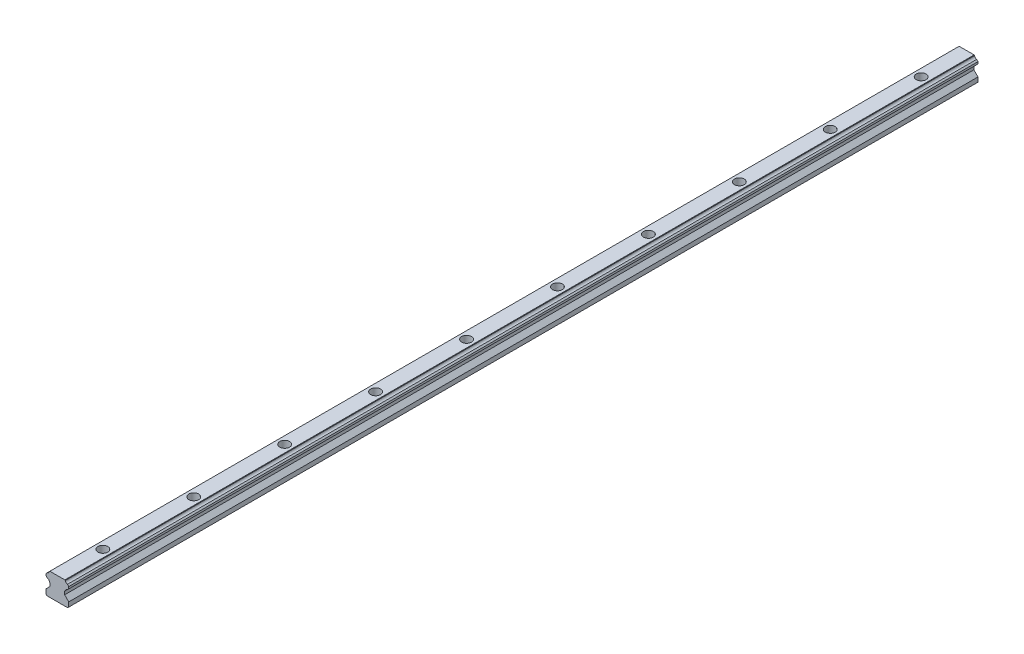
from build123d import *

# Parameters (mm, degrees)
EXTRUDE_1_DEPTH     = 600
SKETCH_2_R          = 3.25
CUT_EXTRUDE_1_DEPTH = 5.3
SKETCH_3_R          = 2.25
CUT_EXTRUDE_2_DEPTH = 601.125270256


with BuildPart() as part:
    # Model → Бобышка-Вытянуть1 (new body)
    with BuildSketch(Plane.XY):
        with BuildLine():
            Line((6.8, 0), (7.5, 0.7))
            Line((7.5, 0.7), (7.5, 3.6994391))
            Line((7.5, 3.6994391), (4.7998047, 6.3996344))
            Line((4.7998047, 6.3996344), (4.7998047, 8.409149262))
            Line((4.7998047, 8.409149262), (5.20075838, 8.810103152))
            ThreePointArc((5.20075838, 8.810103152), (5.668922208, 9.789261508), (6.648080611, 10.257425237))
            Line((6.648080611, 10.257425237), (7.5, 11.109345046))
            Line((7.5, 11.109345046), (7.5, 12.449454443))
            Line((7.5, 12.449454443), (6.634490912, 13.314965186))
            ThreePointArc((6.634490912, 13.314965186), (5.668922174, 13.781617126), (5.202270193, 14.747185846))
            Line((5.202270193, 14.747185846), (4.949456226, 15))
            Line((4.949456226, 15), (-4.949456226, 15))
            Line((-4.949456226, 15), (-5.202270193, 14.747185846))
            ThreePointArc((-5.202270193, 14.747185846), (-5.668922174, 13.781617126), (-6.634490912, 13.314965186))
            Line((-6.634490912, 13.314965186), (-7.5, 12.449454443))
            Line((-7.5, 12.449454443), (-7.5, 11.109345046))
            Line((-7.5, 11.109345046), (-6.648080611, 10.257425238))
            ThreePointArc((-6.648080611, 10.257425238), (-5.668922208, 9.789261508), (-5.20075838, 8.810103152))
            Line((-5.20075838, 8.810103152), (-4.7998047, 8.409149262))
            Line((-4.7998047, 8.409149262), (-4.7998047, 6.3996344))
            Line((-4.7998047, 6.3996344), (-7.5, 3.6994391))
            Line((-7.5, 3.6994391), (-7.5, 0.7))
            Line((-7.5, 0.7), (-6.8, 0))
            Line((-6.8, 0), (6.8, 0))
        make_face()
    extrude(amount=EXTRUDE_1_DEPTH)

    # Эскиз2 → Вырез-Вытянуть1 (cut)
    with BuildSketch(Plane(origin=(0, 15, 0), x_dir=(1, 0, 0), z_dir=(0, 1, 0))):
        with Locations(Location((0, -30, 0), (0, 0, 180))):
            Circle(SKETCH_2_R)
        with Locations(Location((0, -90, 0), (0, 0, 180))):
            Circle(SKETCH_2_R)
        with Locations(Location((0, -150, 0), (0, 0, 180))):
            Circle(SKETCH_2_R)
        with Locations(Location((0, -210, 0), (0, 0, 180))):
            Circle(SKETCH_2_R)
        with Locations(Location((0, -270, 0), (0, 0, 180))):
            Circle(SKETCH_2_R)
        with Locations(Location((0, -330, 0), (0, 0, 180))):
            Circle(SKETCH_2_R)
        with Locations(Location((0, -390, 0), (0, 0, 180))):
            Circle(SKETCH_2_R)
        with Locations(Location((0, -450, 0), (0, 0, 180))):
            Circle(SKETCH_2_R)
        with Locations(Location((0, -510, 0), (0, 0, 180))):
            Circle(SKETCH_2_R)
        with Locations(Location((0, -570, 0), (0, 0, 180))):
            Circle(SKETCH_2_R)
    extrude(amount=-CUT_EXTRUDE_1_DEPTH, mode=Mode.SUBTRACT)

    # Эскиз3 → Вырез-Вытянуть2 (cut, through all)
    with BuildSketch(Plane(origin=(0, 9.7, 0), x_dir=(1, 0, 0), z_dir=(0, 1, 0))):
        with Locations(Location((0, -30, 0), (0, 0, 180))):
            Circle(SKETCH_3_R)
        with Locations(Location((0, -90, 0), (0, 0, 180))):
            Circle(SKETCH_3_R)
        with Locations(Location((0, -150, 0), (0, 0, 180))):
            Circle(SKETCH_3_R)
        with Locations(Location((0, -210, 0), (0, 0, 180))):
            Circle(SKETCH_3_R)
        with Locations(Location((0, -270, 0), (0, 0, 180))):
            Circle(SKETCH_3_R)
        with Locations(Location((0, -330, 0), (0, 0, 180))):
            Circle(SKETCH_3_R)
        with Locations(Location((0, -390, 0), (0, 0, 180))):
            Circle(SKETCH_3_R)
        with Locations(Location((0, -450, 0), (0, 0, 180))):
            Circle(SKETCH_3_R)
        with Locations(Location((0, -510, 0), (0, 0, 180))):
            Circle(SKETCH_3_R)
        with Locations(Location((0, -570, 0), (0, 0, 180))):
            Circle(SKETCH_3_R)
    extrude(amount=-CUT_EXTRUDE_2_DEPTH, mode=Mode.SUBTRACT)


solid = part.part
